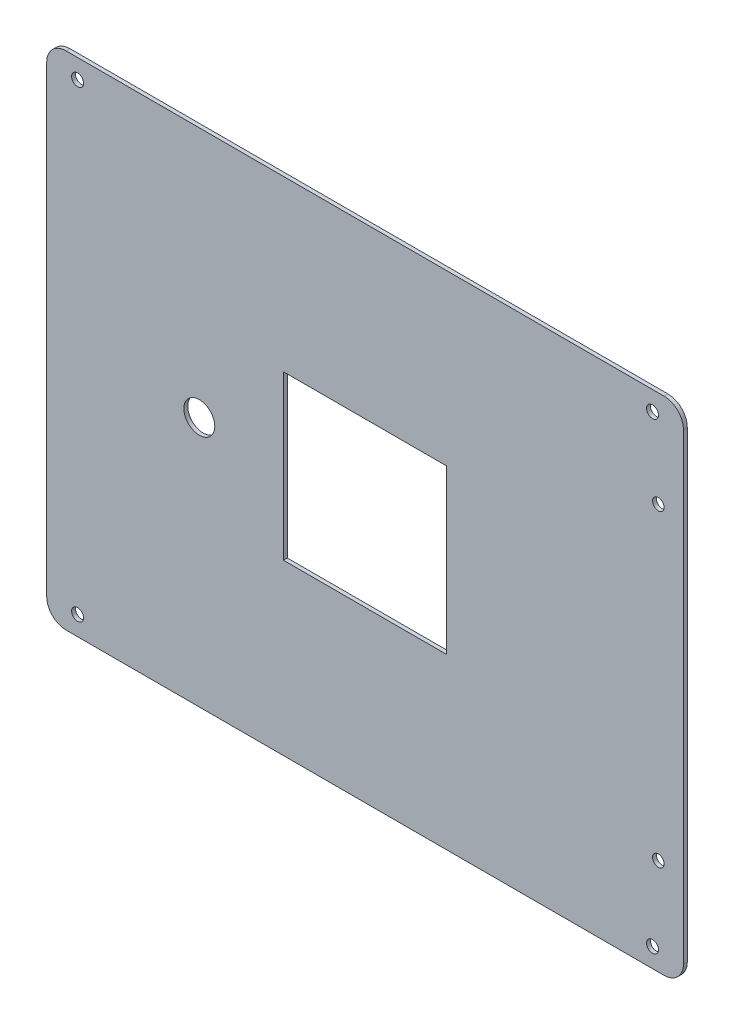
from build123d import *

# Parameters (mm, degrees)
SKETCH_1_R          = 1.55
EXTRUDE_1_DEPTH     = 1
SKETCH_3_R          = 1.5
CUT_EXTRUDE_2_DEPTH = 10
SKETCH_4_R          = 4
CUT_EXTRUDE_3_DEPTH = 10
SKETCH_5_W          = 42.3
SKETCH_5_H          = 42.3
CUT_EXTRUDE_4_DEPTH = 10


with BuildPart() as part:
    # 草图1 → 凸台-拉伸1 (new body)
    with BuildSketch(Plane.XY):
        with BuildLine():
            Line((-77.5, 65), (77.5, 65))
            ThreePointArc((77.5, 65), (81.035533906, 63.535533906), (82.5, 60))
            Line((82.5, 60), (82.5, -60))
            ThreePointArc((82.5, -60), (81.035533906, -63.535533906), (77.5, -65))
            Line((77.5, -65), (-77.5, -65))
            ThreePointArc((-77.5, -65), (-81.035533906, -63.535533906), (-82.5, -60))
            Line((-82.5, -60), (-82.5, 60))
            ThreePointArc((-82.5, 60), (-81.035533906, 63.535533906), (-77.5, 65))
        make_face()
        with Locations((-74.5, 60)):
            Circle(SKETCH_1_R, mode=Mode.SUBTRACT)
        with Locations((74.5, 60)):
            Circle(SKETCH_1_R, mode=Mode.SUBTRACT)
        with Locations((74.5, -60)):
            Circle(SKETCH_1_R, mode=Mode.SUBTRACT)
        with Locations((-74.5, -60)):
            Circle(SKETCH_1_R, mode=Mode.SUBTRACT)
    extrude(amount=EXTRUDE_1_DEPTH)

    # 草图3 → 切除-拉伸2 (cut)
    with BuildSketch(Plane.XY.offset(1)):
        with Locations((76, 40)):
            Circle(SKETCH_3_R)
        with Locations((76, -40)):
            Circle(SKETCH_3_R)
    extrude(amount=-CUT_EXTRUDE_2_DEPTH, mode=Mode.SUBTRACT)

    # 草图4 → 切除-拉伸3 (cut)
    with BuildSketch(Plane.XY.offset(1)):
        with Locations((-42.951152845, 0)):
            Circle(SKETCH_4_R)
    extrude(amount=-CUT_EXTRUDE_3_DEPTH, mode=Mode.SUBTRACT)

    # 草图5 → 切除-拉伸4 (cut)
    with BuildSketch(Plane.XY.offset(1)):
        Rectangle(SKETCH_5_W, SKETCH_5_H)
    extrude(amount=-CUT_EXTRUDE_4_DEPTH, mode=Mode.SUBTRACT)


solid = part.part
